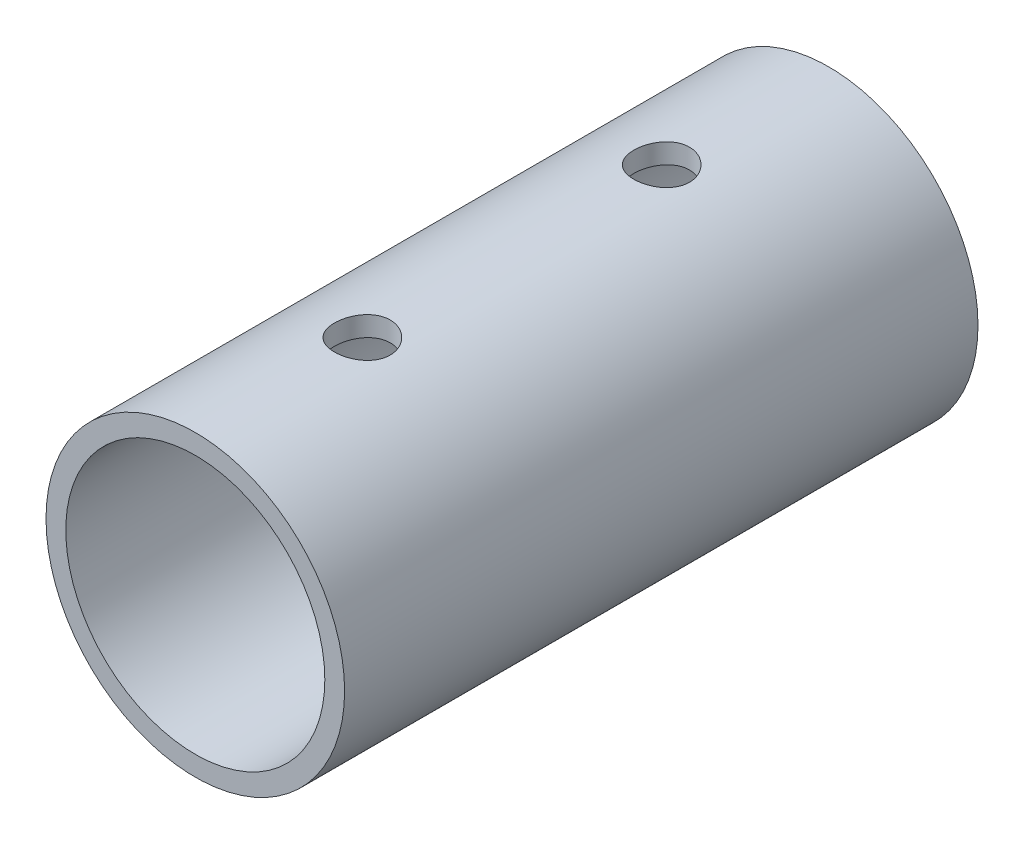
from build123d import *

# Parameters (mm, degrees)
SKETCH1_R               = 17.02644387
SKETCH1_R_2             = 14.7701
BOSS_EXTRUDE1_DEPTH     = 72.23125
CUT_EXTRUDE1_REACH      = 83.651
CUT_EXTRUDE1_END_RADIUS = 14.7701
SKETCH2_R               = 3.175


with BuildPart() as part:
    # Sketch1 → Boss-Extrude1 (new body)
    with BuildSketch(Plane.XY):
        Circle(SKETCH1_R)
        Circle(SKETCH1_R_2, mode=Mode.SUBTRACT)
    extrude(amount=BOSS_EXTRUDE1_DEPTH)

    # Cut-Extrude1: up to this cylinder (the profile starts outside it)
    cut_extrude1_end = Plane(origin=(0, 0, 36.115625), z_dir=(0, 0, -1)) * Cylinder(CUT_EXTRUDE1_END_RADIUS, 231.97345, mode=Mode.PRIVATE)
    # Sketch2 → Cut-Extrude1 (cut, up to the surface)
    with BuildSketch(Plane(origin=(0, 17.02644387, 0), x_dir=(1, 0, 0), z_dir=(0, 1, 0)), mode=Mode.PRIVATE) as cut_extrude1_sk1:
        with Locations(Location((0, -53.18125, 0), (0, 0, 270))):
            Circle(SKETCH2_R)
    cut_extrude1_tool1 = extrude(cut_extrude1_sk1.sketch, amount=-CUT_EXTRUDE1_REACH, mode=Mode.PRIVATE) - cut_extrude1_end
    add(cut_extrude1_tool1.solids().sort_by_distance((0, 17.026444, 53.18125))[0], mode=Mode.SUBTRACT)
    # Sketch2 → Cut-Extrude1 (cut, up to the surface)
    with BuildSketch(Plane(origin=(0, 17.02644387, 0), x_dir=(1, 0, 0), z_dir=(0, 1, 0)), mode=Mode.PRIVATE) as cut_extrude1_sk2:
        with Locations(Location((0, -19.05, 0), (0, 0, 270))):
            Circle(SKETCH2_R)
    cut_extrude1_tool2 = extrude(cut_extrude1_sk2.sketch, amount=-CUT_EXTRUDE1_REACH, mode=Mode.PRIVATE) - cut_extrude1_end
    add(cut_extrude1_tool2.solids().sort_by_distance((0, 17.026444, 19.05))[0], mode=Mode.SUBTRACT)


solid = part.part
